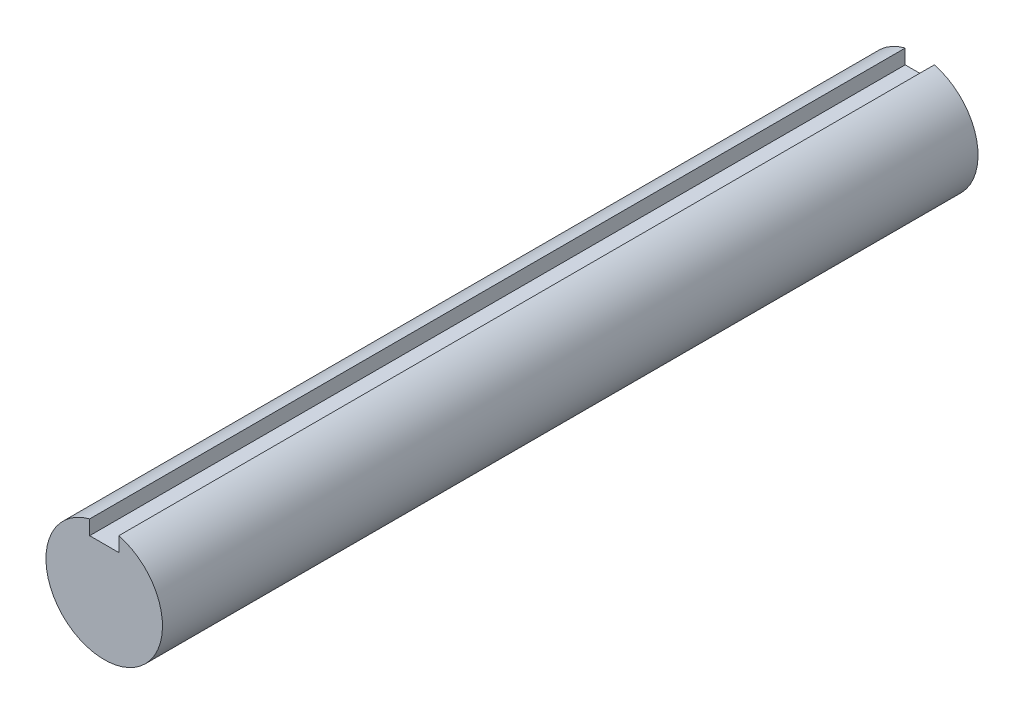
from build123d import *

# Parameters (mm, degrees)
BOSS_EXTRUDE1_DEPTH = 66.675


with BuildPart() as part:
    # Sketch1 → Boss-Extrude1 (new body)
    with BuildSketch(Plane.XY):
        with BuildLine():
            Line((1.190625, 3.420645797), (-1.190625, 3.420645797))
            Line((-1.190625, 3.420645797), (-1.190625, 4.611270797))
            ThreePointArc((-1.190625, 4.611270797), (0, -4.7625), (1.190625, 4.611270797))
            Line((1.190625, 4.611270797), (1.190625, 3.420645797))
        make_face()
    extrude(amount=BOSS_EXTRUDE1_DEPTH)


solid = part.part
